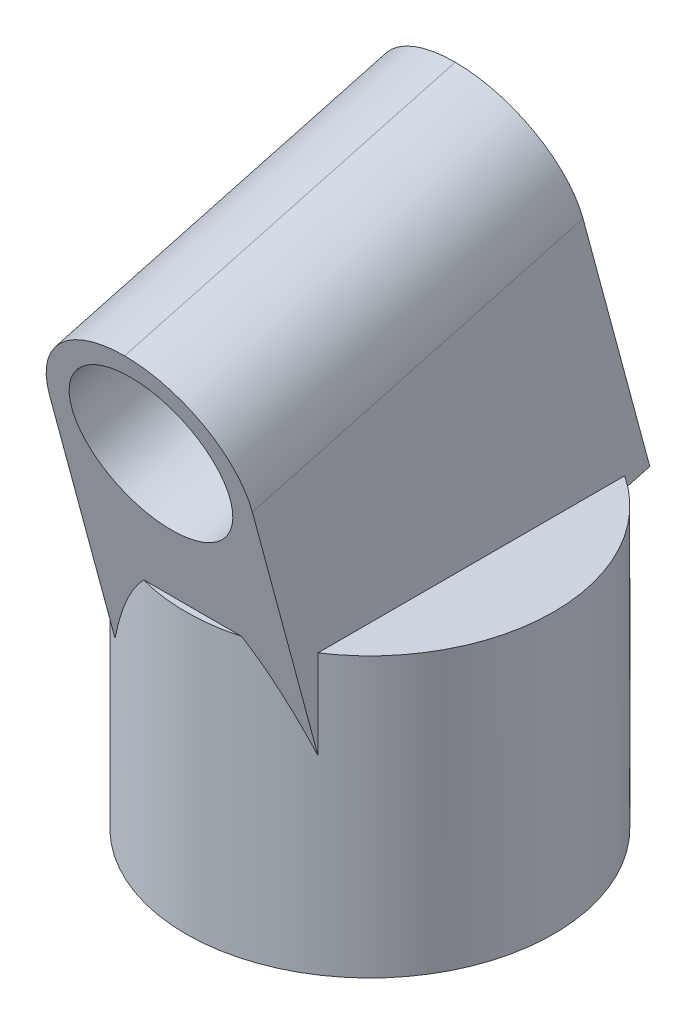
from build123d import *

# Parameters (mm, degrees)
SKETCH1_R                = 14.5
SKETCH1_R_2              = 12.5
BOSS_EXTRUDE1_DEPTH      = 20
SKETCH2_R                = 14.5
BOSS_EXTRUDE2_DEPTH      = 2
BOSS_EXTRUDE3_DEPTH      = 17
BOSS_EXTRUDE3_DEPTH_BACK = 4
SKETCH4_W                = 16
SKETCH4_H                = 27
BOSS_EXTRUDE4_DEPTH      = 7.25
FILLET1_R                = 7.99
FILLET2_R                = 7.99
CUT_EXTRUDE2_DEPTH       = 58.363166746
CUT_EXTRUDE2_DEPTH_BACK  = 58.363166746
SKETCH7_R                = 6.25


with BuildPart() as part:
    # Sketch1 → Boss-Extrude1 (new body)
    with BuildSketch(Plane(origin=(0, 0, 0), x_dir=(1, 0, 0), z_dir=(0, 1, 0))):
        with Locations(Location((0, 0, 0), (0, 0, 270))):
            Circle(SKETCH1_R)
        with Locations(Location((0, 0, 0), (0, 0, 270))):
            Circle(SKETCH1_R_2, mode=Mode.SUBTRACT)
    extrude(amount=BOSS_EXTRUDE1_DEPTH)

    # Sketch2 → Boss-Extrude2 (add)
    with BuildSketch(Plane(origin=(0, 20, 0), x_dir=(1, 0, 0), z_dir=(0, 1, 0))):
        with Locations(Location((0, 0, 0), (0, 0, 270))):
            Circle(SKETCH2_R)
    extrude(amount=BOSS_EXTRUDE2_DEPTH)

    # Sketch3 → Boss-Extrude3 (add, two sides: drawn at the far end of the back side and taken through both)
    with BuildSketch(Plane(origin=(0, 20.513428876, 5.522198024), x_dir=(-1, 0, 0), z_dir=(0, 0.9656234179447285, 0.2599450224888722)).offset(-BOSS_EXTRUDE3_DEPTH_BACK)):
        Polygon((8, -19.22), (8, -5.72), (8, 7.78), (-8, 7.78), (-8, -19.22), align=None)
    extrude(amount=BOSS_EXTRUDE3_DEPTH + BOSS_EXTRUDE3_DEPTH_BACK)

    # Sketch4 → Boss-Extrude4 (add)
    with BuildSketch(Plane(origin=(0, 36.929026981, 9.941263406), x_dir=(1, 0, 0), z_dir=(0, 0.9656234179447285, 0.25994502248887214))):
        with Locations((0, 5.72)):
            Rectangle(SKETCH4_W, SKETCH4_H)
    extrude(amount=BOSS_EXTRUDE4_DEPTH)

    # Fillet1
    fillet1_edges = [part.edges().sort_by_distance(p)[0] for p in [
        (8, 45.41668229, 6.302498869),
    ]]
    fillet(fillet1_edges, radius=FILLET1_R)

    # Fillet2
    fillet2_edges = [part.edges().sort_by_distance(p)[0] for p in [
        (-8, 45.41668229, 6.302498869),
    ]]
    fillet(fillet2_edges, radius=FILLET2_R)

    # Sketch7 → Cut-Extrude2 (cut, two sides: drawn at the far end of the back side and taken through both)
    with BuildSketch(Plane(origin=(0, -2.022372275, 7.512550192), x_dir=(1, 0, 0), z_dir=(0, -0.2599450224888722, 0.9656234179447285)).offset(-CUT_EXTRUDE2_DEPTH_BACK)):
        with Locations(Location((0, 37.503715195, 0), (0, 0, 90))):
            Circle(SKETCH7_R)
    extrude(amount=CUT_EXTRUDE2_DEPTH + CUT_EXTRUDE2_DEPTH_BACK, mode=Mode.SUBTRACT)


solid = part.part
